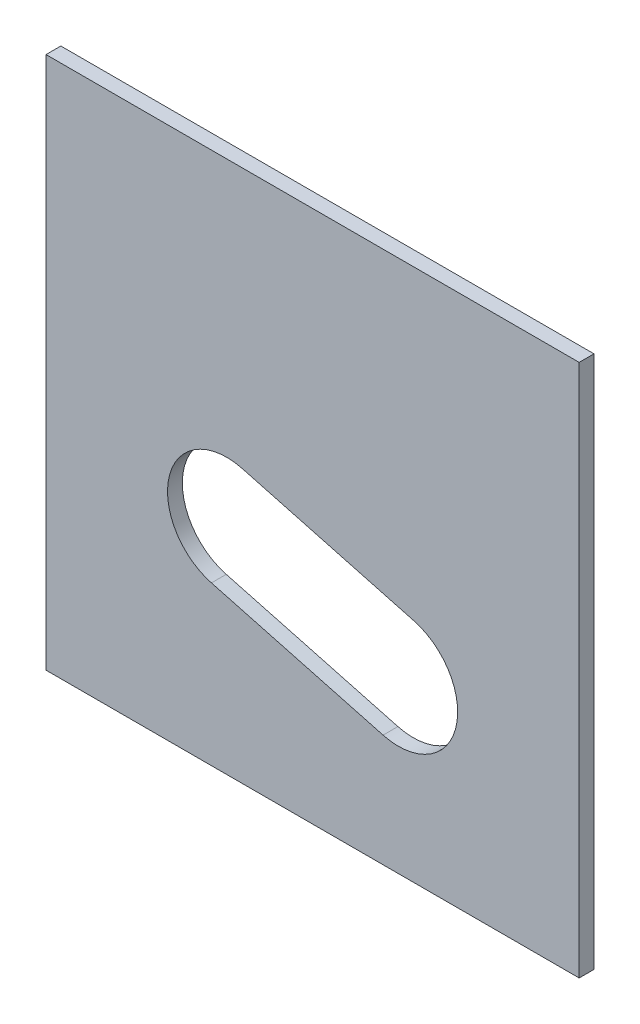
from build123d import *

# Parameters (mm, degrees)
SKETCH1_W           = 180
SKETCH1_H           = 180
BOSS_EXTRUDE1_DEPTH = 5
CUT_EXTRUDE1_DEPTH  = 128.377392029


with BuildPart() as part:
    # Sketch1 → Boss-Extrude1 (new body)
    with BuildSketch(Plane.XY):
        Rectangle(SKETCH1_W, SKETCH1_H)
    extrude(amount=BOSS_EXTRUDE1_DEPTH)

    # Sketch3 → Cut-Extrude1 (cut, through all)
    with BuildSketch(Plane(origin=(0, 0, 0), x_dir=(-1, 0, 0), z_dir=(0, 0, -1))):
        with BuildLine():
            Line((-34.154155691, -13.446054827), (23.801393887, 2.083087879))
            ThreePointArc((23.801393887, 2.083087879), (48.296291314, -12.059047745), (34.154155691, -36.553945173))
            Line((34.154155691, -36.553945173), (-23.801393887, -52.083087879))
            ThreePointArc((-23.801393887, -52.083087879), (-48.296291314, -37.940952255), (-34.154155691, -13.446054827))
        make_face()
    extrude(amount=-CUT_EXTRUDE1_DEPTH, mode=Mode.SUBTRACT)


solid = part.part
